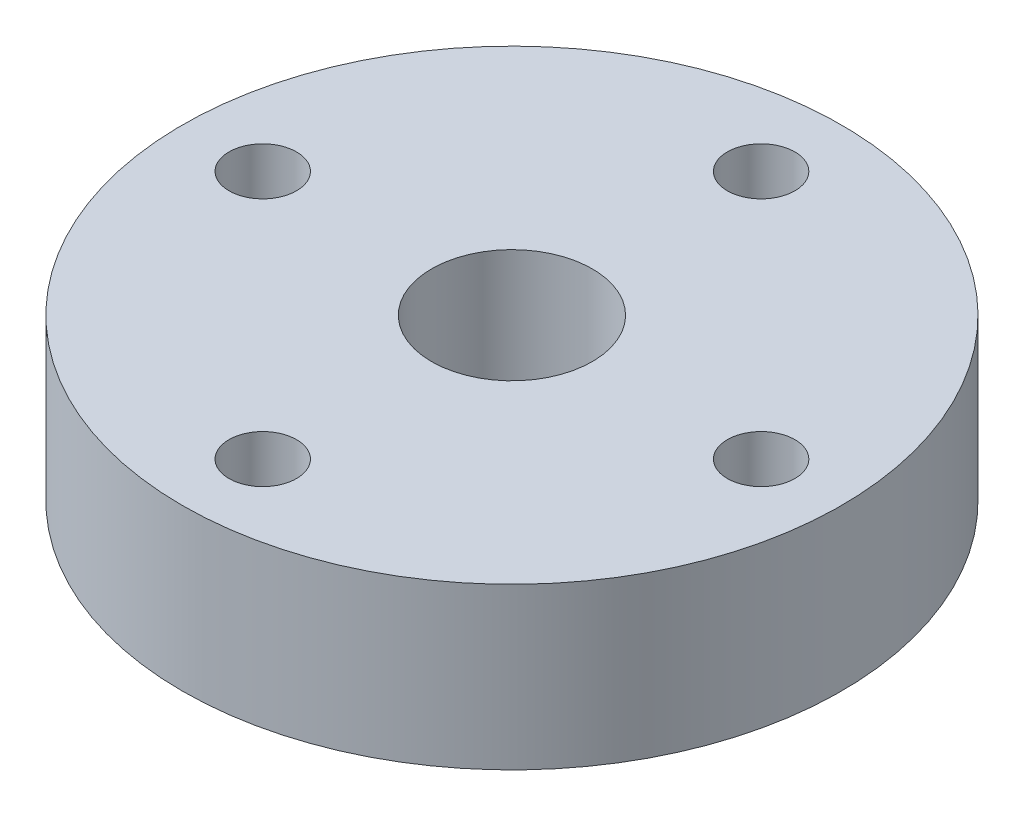
from build123d import *

# Parameters (mm, degrees)
SKETCH_1_R      = 20.5
SKETCH_1_R_2    = 5
SKETCH_1_R_3    = 2.1
EXTRUDE_1_DEPTH = 10


with BuildPart() as part:
    # 草图1 → 凸台-拉伸1 (new body)
    with BuildSketch(Plane(origin=(0, 0, 0), x_dir=(1, 0, 0), z_dir=(0, 1, 0))):
        with Locations(Location((0, 0, 0), (0, 0, 270))):
            Circle(SKETCH_1_R)
        with Locations(Location((0, 0, 0), (0, 0, 270))):
            Circle(SKETCH_1_R_2, mode=Mode.SUBTRACT)
        with Locations(Location((0, 15.5, 0), (0, 0, 270))):
            Circle(SKETCH_1_R_3, mode=Mode.SUBTRACT)
        with Locations(Location((15.5, 0, 0), (0, 0, 270))):
            Circle(SKETCH_1_R_3, mode=Mode.SUBTRACT)
        with Locations(Location((0, -15.5, 0), (0, 0, 270))):
            Circle(SKETCH_1_R_3, mode=Mode.SUBTRACT)
        with Locations(Location((-15.5, 0, 0), (0, 0, 270))):
            Circle(SKETCH_1_R_3, mode=Mode.SUBTRACT)
    extrude(amount=EXTRUDE_1_DEPTH)


solid = part.part
